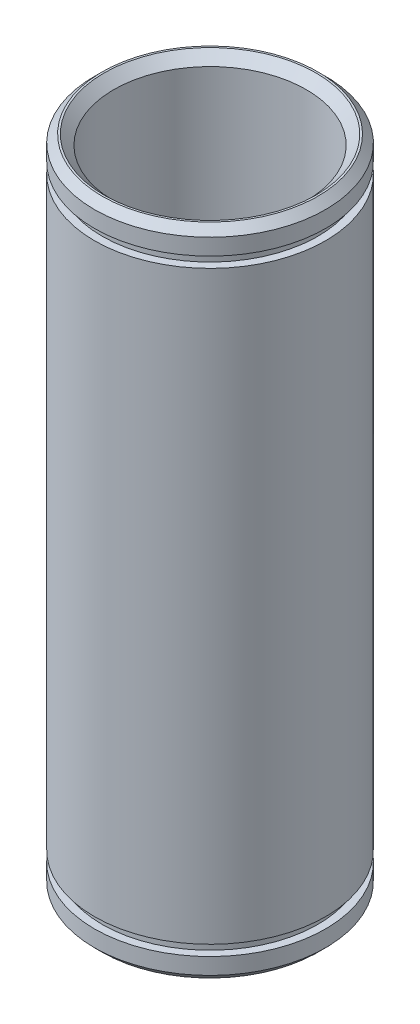
from build123d import *

# Parameters (mm, degrees)
SKETCH1_R           = 15
SKETCH1_R_2         = 12.5
BOSS_EXTRUDE1_DEPTH = 85
CUT_EXTRUDE1_START  = -1.375
SKETCH2_R           = 15
SKETCH2_R_2         = 14
CUT_EXTRUDE1_DEPTH  = 1.375
CHAMFER1_SIZE       = 1.25
CHAMFER2_SIZE       = 1


with BuildPart() as part:
    # Sketch1 → Boss-Extrude1 (new body)
    with BuildSketch(Plane(origin=(0, 0, 0), x_dir=(1, 0, 0), z_dir=(0, 1, 0))):
        with Locations(Location((0, 0, 0), (0, 0, 270))):
            Circle(SKETCH1_R)
        with Locations(Location((0, 0, 0), (0, 0, 270))):
            Circle(SKETCH1_R_2, mode=Mode.SUBTRACT)
    extrude(amount=BOSS_EXTRUDE1_DEPTH)

    # Sketch2 → Cut-Extrude1 (cut)
    with BuildSketch(Plane(origin=(0, 81.875, 0), x_dir=(1, 0, 0), z_dir=(0, 1, 0)).offset(CUT_EXTRUDE1_START)):
        with Locations(Location((0, 0, 0), (0, 0, 270))):
            Circle(SKETCH2_R)
        with Locations(Location((0, 0, 0), (0, 0, 270))):
            Circle(SKETCH2_R_2, mode=Mode.SUBTRACT)
    cut_extrude1 = extrude(amount=CUT_EXTRUDE1_DEPTH, mode=Mode.SUBTRACT)

    # Mirror1: Cut-Extrude1 across plane
    add(cut_extrude1.mirror(Plane.ZX.offset(42.5)), mode=Mode.SUBTRACT)

    # Chamfer1
    chamfer1_edges = [part.edges().sort_by_distance(p)[0] for p in [
        (0, 0, -12.5),
        (0, 85, -12.5),
    ]]
    chamfer(chamfer1_edges, length=CHAMFER1_SIZE)

    # Chamfer2
    chamfer2_edges = [part.edges().sort_by_distance(p)[0] for p in [
        (0, 0, -15),
        (0, 85, -15),
    ]]
    chamfer(chamfer2_edges, length=CHAMFER2_SIZE)


solid = part.part
